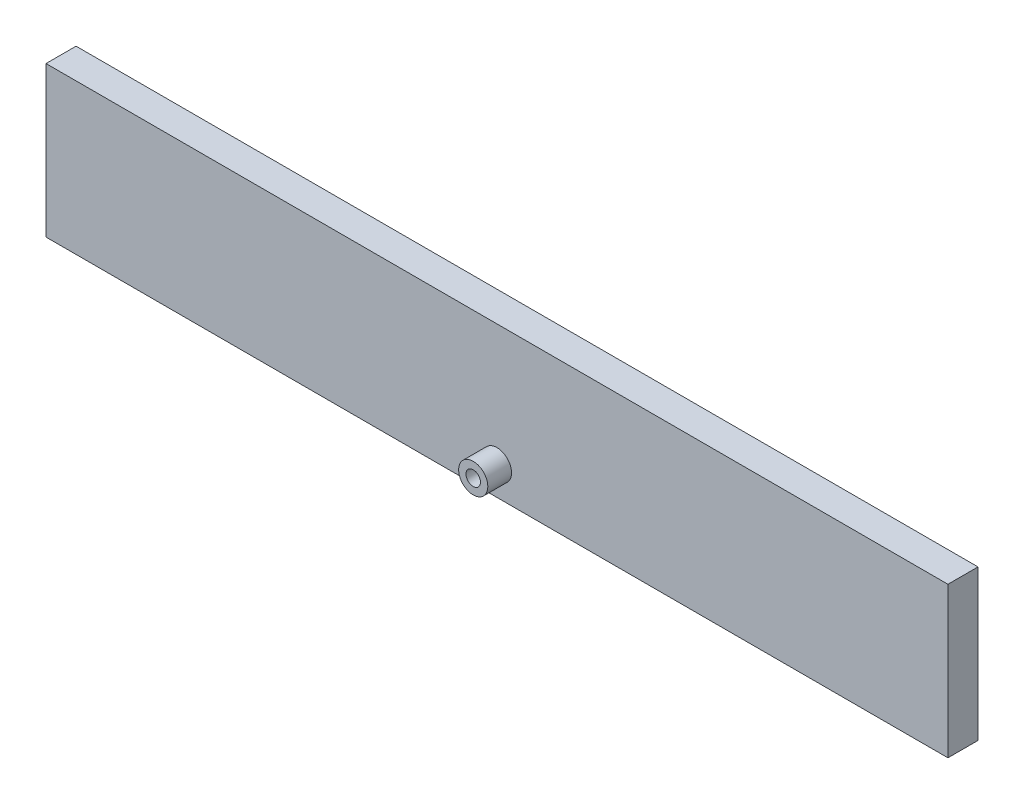
from build123d import *

# Parameters (mm, degrees)
SKETCH1_W           = 600
SKETCH1_H           = 100
BOSS_EXTRUDE1_DEPTH = 20
SKETCH2_R           = 9.7
SKETCH2_R_2         = 4.826
BOSS_EXTRUDE2_DEPTH = 15.8


with BuildPart() as part:
    # Sketch1 → Boss-Extrude1 (new body)
    with BuildSketch(Plane.XY):
        Rectangle(SKETCH1_W, SKETCH1_H)
    extrude(amount=BOSS_EXTRUDE1_DEPTH)

    # Sketch2 → Boss-Extrude2 (add)
    with BuildSketch(Plane.XY.offset(20)):
        with Locations((0, -30.95)):
            Circle(SKETCH2_R)
        with Locations((0, -30.95)):
            Circle(SKETCH2_R_2, mode=Mode.SUBTRACT)
    extrude(amount=BOSS_EXTRUDE2_DEPTH)


solid = part.part
